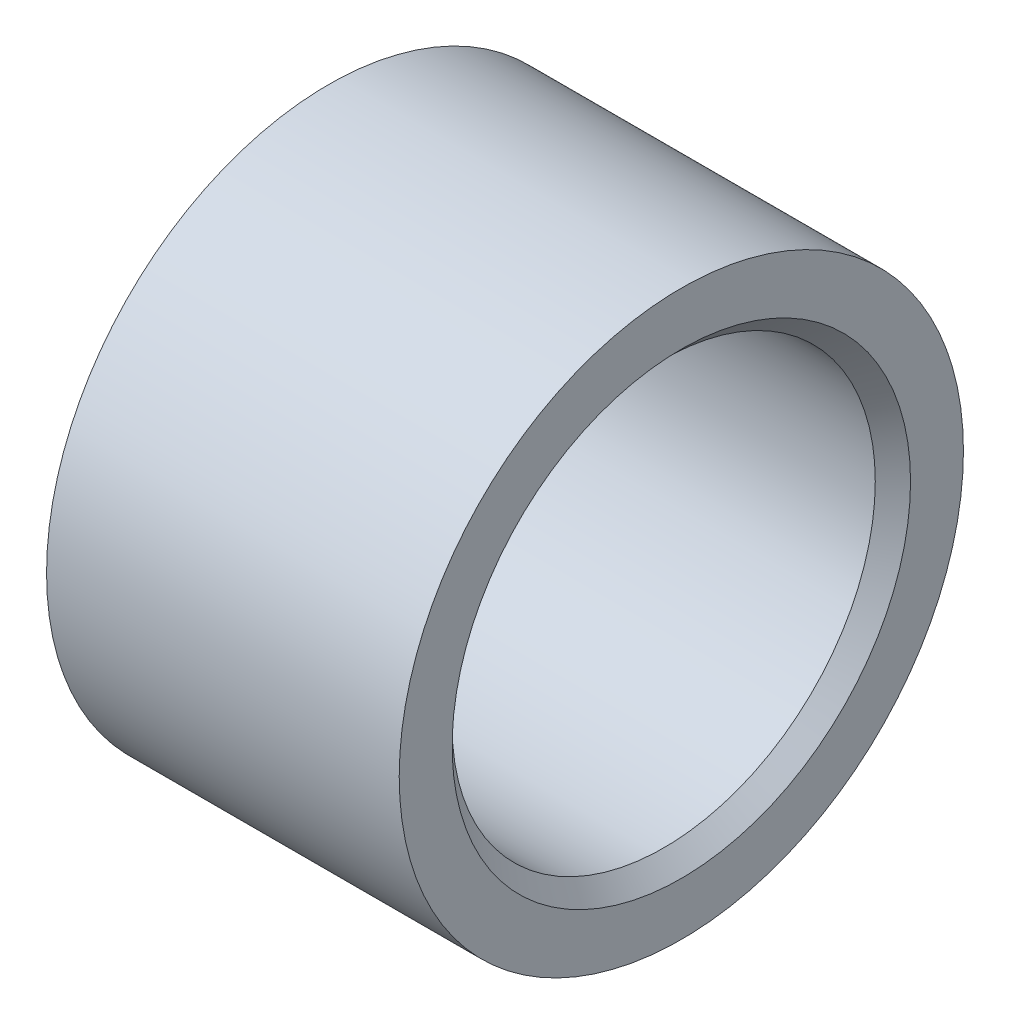
from build123d import *

# Parameters (mm, degrees)
SZKIC1_R                    = 8
SZKIC1_R_2                  = 6
DODANIE_WYCI_GNI_CIE1_DEPTH = 10
SFAZOWANIE1_SIZE            = 0.5


with BuildPart() as part:
    # Szkic1 → Dodanie-wyciągnięcie1 (new body)
    with BuildSketch(Plane(origin=(0, 0, 0), x_dir=(0, 0, -1), z_dir=(1, 0, 0))):
        Circle(SZKIC1_R)
        Circle(SZKIC1_R_2, mode=Mode.SUBTRACT)
    extrude(amount=DODANIE_WYCI_GNI_CIE1_DEPTH)

    # Sfazowanie1
    sfazowanie1_edges = [part.edges().sort_by_distance(p)[0] for p in [
        (0, 0, 6),
        (10, 0, 6),
    ]]
    chamfer(sfazowanie1_edges, length=SFAZOWANIE1_SIZE)


solid = part.part
